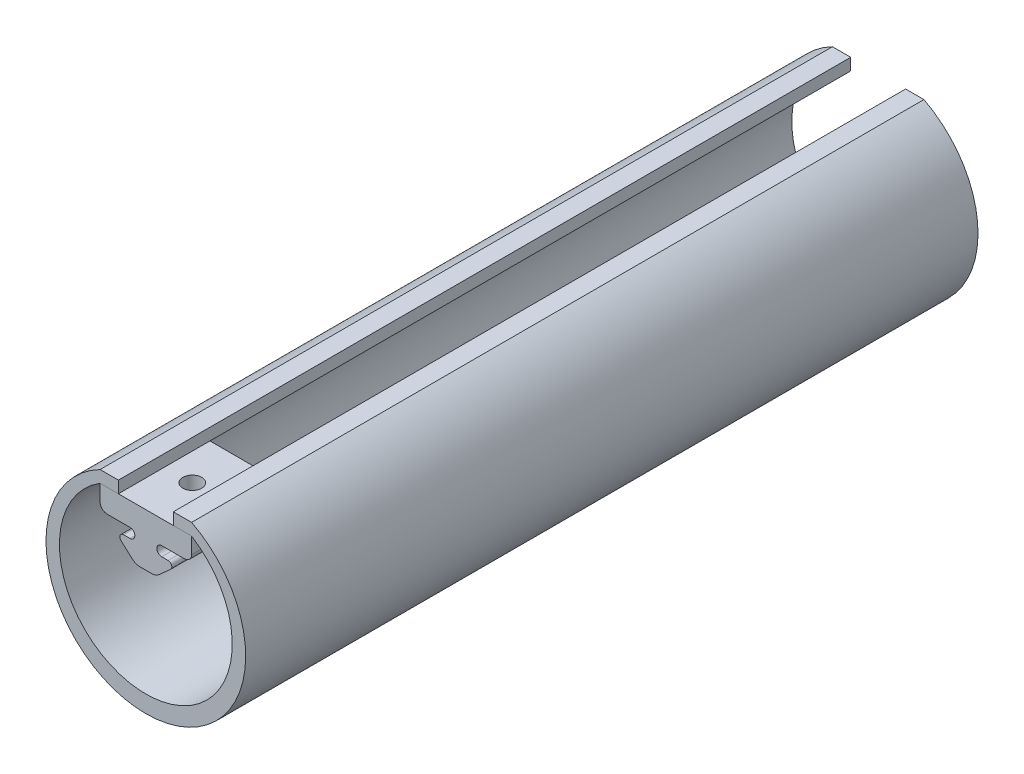
from build123d import *

# Parameters (mm, degrees)
EXTRUDE1_DEPTH      = 25
SKETCH2_R           = 2.5796875
CUT_EXTRUDE1_DEPTH  = 32.407601389
SKETCH5_W           = 5
SKETCH5_H           = 3.237358095
BOSS_EXTRUDE1_DEPTH = 200


with BuildPart() as part:
    # Sketch1 → Extrude1 (new body)
    with BuildSketch(Plane.XY):
        with BuildLine():
            Line((4.315, 12.745), (10.532068835, 12.745))
            ThreePointArc((10.532068835, 12.745), (11.926539753, 13.316381695), (12.505, 14.707931165))
            Line((12.505, 14.707931165), (12.505, 19.095))
            Line((12.505, 19.095), (-12.495, 19.095))
            Line((-12.495, 19.095), (-12.495, 14.707931165))
            ThreePointArc((-12.495, 14.707931165), (-11.920070773, 13.319929227), (-10.532068835, 12.745))
            Line((-10.532068835, 12.745), (-4.315, 12.745))
            ThreePointArc((-4.315, 12.745), (-3, 11.43), (-4.315, 10.115))
            Line((-4.315, 10.115), (-6.085, 10.115))
            ThreePointArc((-6.085, 10.115), (-7.028446777, 9.465566469), (-6.758614403, 8.352441938))
            Line((-6.758614403, 8.352441938), (-3.664622209, 5.583010835))
            ThreePointArc((-3.664622209, 5.583010835), (-2.682085626, 4.983884868), (-1.550406707, 4.775))
            Line((-1.550406707, 4.775), (1.550406707, 4.775))
            ThreePointArc((1.550406707, 4.775), (2.682085626, 4.983884868), (3.664622209, 5.583010835))
            Line((3.664622209, 5.583010835), (6.758614403, 8.352441938))
            ThreePointArc((6.758614403, 8.352441938), (7.028446777, 9.465566469), (6.085, 10.115))
            Line((6.085, 10.115), (4.315, 10.115))
            ThreePointArc((4.315, 10.115), (3, 11.43), (4.315, 12.745))
        make_face()
    extrude(amount=-EXTRUDE1_DEPTH)

    # Sketch2 → Cut-Extrude1 (cut, through all)
    with BuildSketch(Plane(origin=(0, 19.095, 0), x_dir=(1, 0, 0), z_dir=(0, 1, 0))):
        with Locations(Location((0, 12.7, 0), (0, 0, 126.94195449))):
            Circle(SKETCH2_R)
    extrude(amount=-CUT_EXTRUDE1_DEPTH, mode=Mode.SUBTRACT)


with BuildPart() as body_2:
    # Sketch5 → Boss-Extrude1 (new body)
    with BuildSketch(Plane.XY):
        with BuildLine():
            Line((-12.495, 19.095), (-12.495, 22.332358095))
            ThreePointArc((-12.495, 22.332358095), (0.005, -29.167686251), (12.505, 22.332358095))
            Line((12.505, 22.332358095), (12.505, 19.095))
            ThreePointArc((12.505, 19.095), (0.005, -24.517190702), (-12.495, 19.095))
        make_face()
        with Locations((-9.995, 20.713679048)):
            Rectangle(SKETCH5_W, SKETCH5_H)
        with Locations((10.005, 20.713679048)):
            Rectangle(SKETCH5_W, SKETCH5_H)
    extrude(amount=-BOSS_EXTRUDE1_DEPTH)


solid = Compound([part.part, body_2.part])
